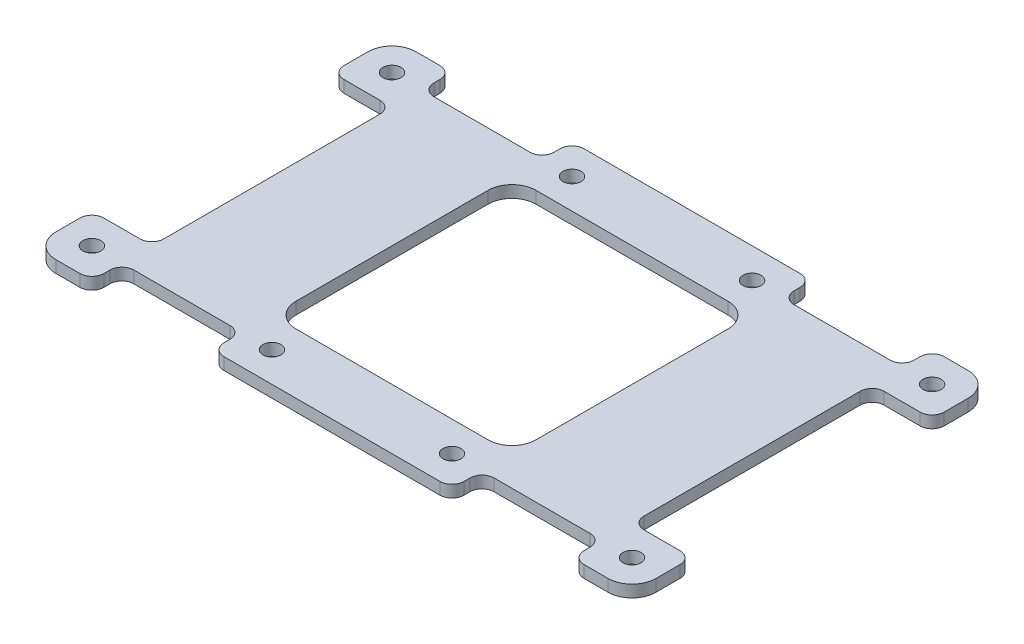
from build123d import *

# Parameters (mm, degrees)
SKETCH_1_W          = 100
SKETCH_1_H          = 60
EXTRUDE_1_DEPTH     = 2
SKETCH_4_W          = 40
SKETCH_4_H          = 40
CUT_EXTRUDE_3_DEPTH = 59.343808583
SKETCH_6_R          = 1.5
CUT_EXTRUDE_5_DEPTH = 59.343808583
SKETCH_7_W          = 20
SKETCH_7_H          = 5
CUT_EXTRUDE_6_DEPTH = 59.343808583
FILLET_1_R          = 4
FILLET_2_R          = 2
SKETCH_8_R          = 1.5
CUT_EXTRUDE_7_DEPTH = 59.343808583
SKETCH_9_W          = 10
SKETCH_9_H          = 40
CUT_EXTRUDE_9_DEPTH = 59.343808583
FILLET_3_R          = 2


with BuildPart() as part:
    # 草图1 → 凸台-拉伸1 (new body)
    with BuildSketch(Plane(origin=(0, 0, 0), x_dir=(1, 0, 0), z_dir=(0, 1, 0))):
        Rectangle(SKETCH_1_W, SKETCH_1_H)
    extrude(amount=EXTRUDE_1_DEPTH)

    # 草图4 → 切除-拉伸3 (cut, through all)
    with BuildSketch(Plane(origin=(0, 2, 0), x_dir=(1, 0, 0), z_dir=(0, 1, 0))):
        Rectangle(SKETCH_4_W, SKETCH_4_H)
    extrude(amount=-CUT_EXTRUDE_3_DEPTH, mode=Mode.SUBTRACT)

    # 草图6 → 切除-拉伸5 (cut, through all)
    with BuildSketch(Plane(origin=(0, 2, 0), x_dir=(1, 0, 0), z_dir=(0, 1, 0))):
        with Locations(Location((-45, 25, 0), (0, 0, 270))):
            Circle(SKETCH_6_R)
        with Locations(Location((-45, -25, 0), (0, 0, 90))):
            Circle(SKETCH_6_R)
        with Locations(Location((45, -25, 0), (0, 0, 270))):
            Circle(SKETCH_6_R)
        with Locations(Location((45, 25, 0), (0, 0, 90))):
            Circle(SKETCH_6_R)
    extrude(amount=-CUT_EXTRUDE_5_DEPTH, mode=Mode.SUBTRACT)

    # 草图7 → 切除-拉伸6 (cut, through all)
    with BuildSketch(Plane(origin=(0, 2, 0), x_dir=(1, 0, 0), z_dir=(0, 1, 0))):
        with Locations((-30, 27.5)):
            Rectangle(SKETCH_7_W, SKETCH_7_H)
        with Locations((-30, -27.5)):
            Rectangle(SKETCH_7_W, SKETCH_7_H)
        with Locations((30, -27.5)):
            Rectangle(SKETCH_7_W, SKETCH_7_H)
        with Locations((30, 27.5)):
            Rectangle(SKETCH_7_W, SKETCH_7_H)
    extrude(amount=-CUT_EXTRUDE_6_DEPTH, mode=Mode.SUBTRACT)

    # 圆角1
    fillet_1_edges = [part.edges().sort_by_distance(p)[0] for p in [
        (20, 1, -20),
        (20, 1, 20),
        (-20, 1, 20),
        (-20, 1, -20),
        (50, 1, 30),
        (-50, 1, 30),
        (-50, 1, -30),
        (50, 1, -30),
    ]]
    fillet(fillet_1_edges, radius=FILLET_1_R)

    # 圆角2
    fillet_2_edges = [part.edges().sort_by_distance(p)[0] for p in [
        (40, 1, -30),
        (40, 1, -25),
        (20, 1, -25),
        (20, 1, -30),
        (40, 1, 30),
        (20, 1, 30),
        (20, 1, 25),
        (40, 1, 25),
        (-40, 1, 30),
        (-40, 1, 25),
        (-20, 1, 25),
        (-20, 1, 30),
        (-40, 1, -25),
        (-40, 1, -30),
        (-20, 1, -30),
        (-20, 1, -25),
    ]]
    fillet(fillet_2_edges, radius=FILLET_2_R)

    # 草图8 → 切除-拉伸7 (cut, through all)
    with BuildSketch(Plane(origin=(0, 2, 0), x_dir=(1, 0, 0), z_dir=(0, 1, 0))):
        with Locations(Location((-15, 25, 0), (0, 0, 270))):
            Circle(SKETCH_8_R)
        with Locations(Location((-15, -25, 0), (0, 0, 90))):
            Circle(SKETCH_8_R)
        with Locations(Location((15, -25, 0), (0, 0, 270))):
            Circle(SKETCH_8_R)
        with Locations(Location((15, 25, 0), (0, 0, 90))):
            Circle(SKETCH_8_R)
    extrude(amount=-CUT_EXTRUDE_7_DEPTH, mode=Mode.SUBTRACT)

    # 草图9 → 切除-拉伸9 (cut, through all)
    with BuildSketch(Plane(origin=(0, 2, 0), x_dir=(1, 0, 0), z_dir=(0, 1, 0))):
        with Locations((-45, 0)):
            Rectangle(SKETCH_9_W, SKETCH_9_H)
        with Locations((45, 0)):
            Rectangle(SKETCH_9_W, SKETCH_9_H)
    extrude(amount=-CUT_EXTRUDE_9_DEPTH, mode=Mode.SUBTRACT)

    # 圆角3
    fillet_3_edges = [part.edges().sort_by_distance(p)[0] for p in [
        (-50, 1, 20),
        (-50, 1, -20),
        (-40, 1, -20),
        (-40, 1, 20),
        (50, 1, -20),
        (50, 1, 20),
        (40, 1, 20),
        (40, 1, -20),
    ]]
    fillet(fillet_3_edges, radius=FILLET_3_R)


solid = part.part
